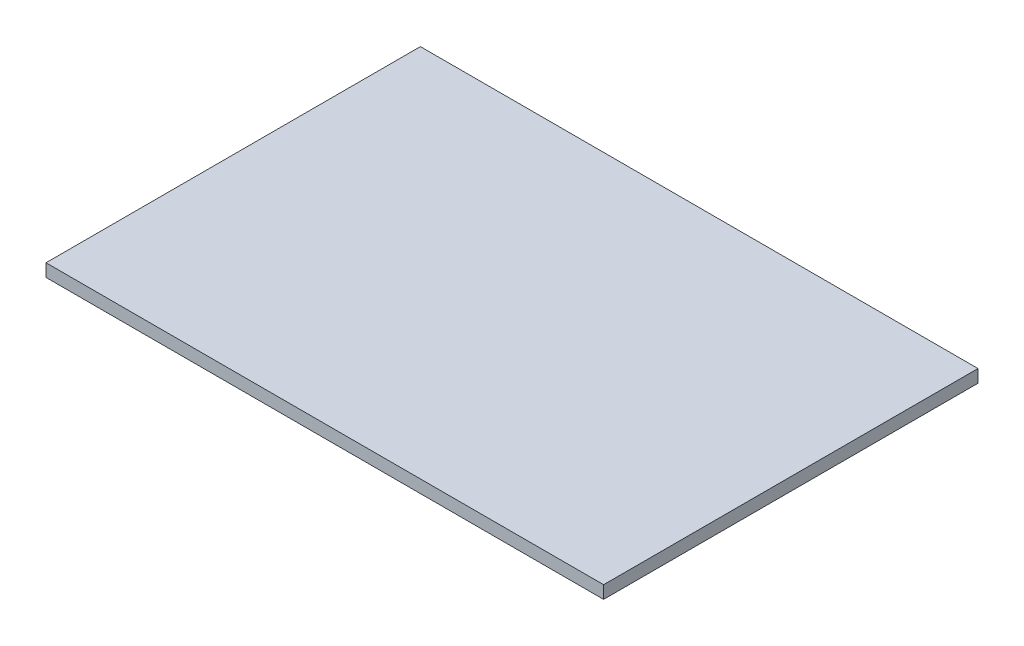
from build123d import *

# Parameters (mm, degrees)
SKETCH_1_W      = 70
SKETCH_1_H      = 47
EXTRUDE_1_DEPTH = 1.6


with BuildPart() as part:
    # 草图1 → 凸台-拉伸1 (new body)
    with BuildSketch(Plane(origin=(0, 0, 0), x_dir=(1, 0, 0), z_dir=(0, 1, 0))):
        Rectangle(SKETCH_1_W, SKETCH_1_H)
    extrude(amount=EXTRUDE_1_DEPTH)


solid = part.part
